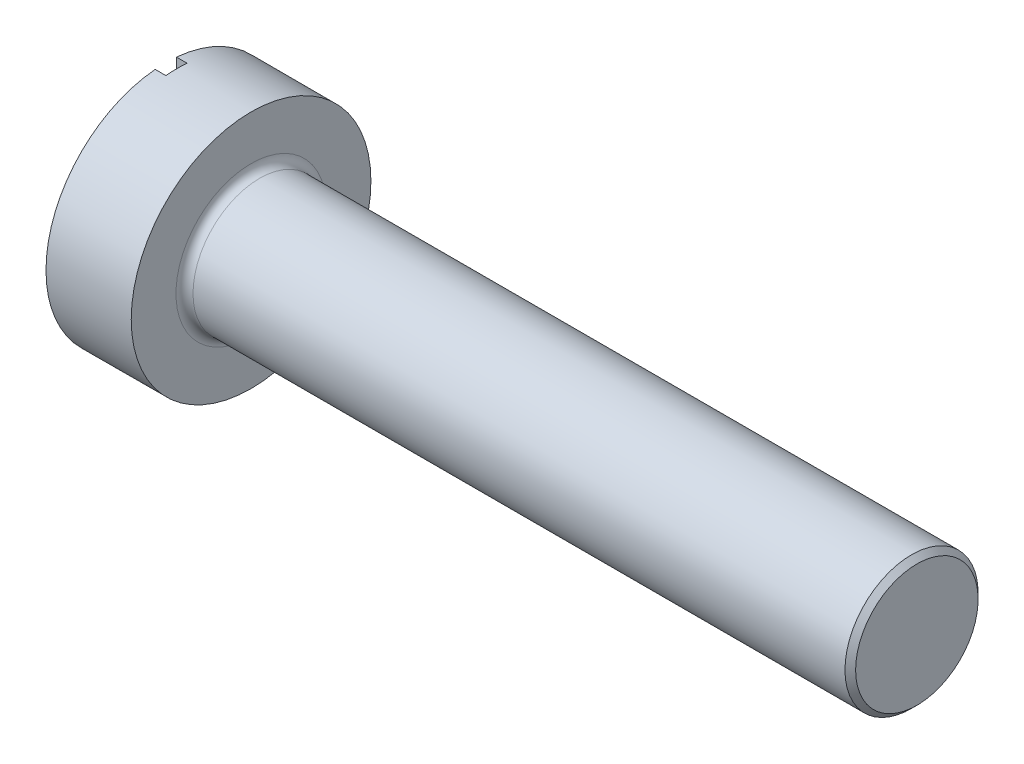
from build123d import *

# Parameters (mm, degrees)
CHAMFER1_SIZE       = 0.1
FILLET1_R           = 0.16
EXTRUDE1_DEPTH      = 15.454584048
EXTRUDE1_DEPTH_BACK = 15.454584048
SKETCH2_W           = 0.2
SKETCH2_H           = 0.2


with BuildPart() as part:
    # Sketch1 → Revolve1 (revolve)
    with BuildSketch(Plane.XY, mode=Mode.PRIVATE) as revolve1_sk:
        Polygon((0, 2.25), (0, 0), (14.1, 0), (14.1, 1.25), (1.6, 1.25), (1.6, 2.25), align=None)
    revolve(revolve1_sk.sketch.rotate(Axis((0, 0, 0), (1, 0, 0)), 90), axis=Axis((0, 0, 0), (1, 0, 0)))

    # Chamfer1
    chamfer1_edges = [part.edges().sort_by_distance(p)[0] for p in [
        (14.1, 0, -1.25),
    ]]
    chamfer(chamfer1_edges, length=CHAMFER1_SIZE)

    # Fillet1
    fillet1_edges = [part.edges().sort_by_distance(p)[0] for p in [
        (1.6, 0, -1.25),
    ]]
    fillet(fillet1_edges, radius=FILLET1_R)

    # Sketch2 → Extrude1 (cut, two sides: drawn at the far end of the back side and taken through both)
    with BuildSketch(Plane(origin=(0, 0, 0), x_dir=(1, 0, 0), z_dir=(0, 1, 0)).offset(-EXTRUDE1_DEPTH_BACK)):
        with Locations((0.1, -0.1)):
            Rectangle(SKETCH2_W, SKETCH2_H)
        with Locations((0.1, 0.1)):
            Rectangle(SKETCH2_W, SKETCH2_H)
    extrude(amount=EXTRUDE1_DEPTH + EXTRUDE1_DEPTH_BACK, mode=Mode.SUBTRACT)


solid = part.part
